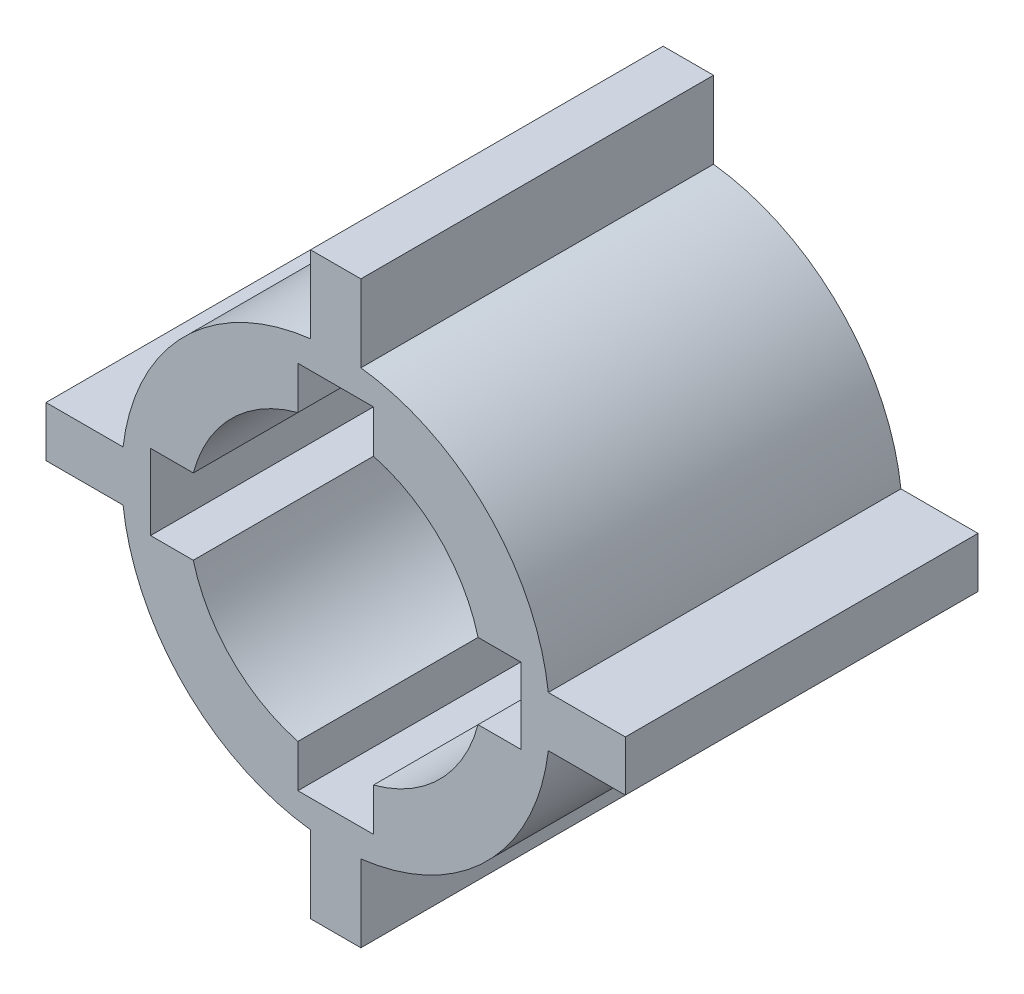
from build123d import *

# Parameters (mm, degrees)
BOSS_EXTRUDE1_DEPTH = 14


with BuildPart() as part:
    # Sketch1 → Boss-Extrude1 (new body)
    with BuildSketch(Plane.XY):
        with BuildLine():
            Line((-1, 8.440971508), (-1, 11.5))
            Line((-1, 11.5), (1, 11.5))
            Line((1, 11.5), (1, 8.440971508))
            ThreePointArc((1, 8.440971508), (6.01040764, 6.01040764), (8.440971508, 1))
            Line((8.440971508, 1), (11.5, 1))
            Line((11.5, 1), (11.5, -1))
            Line((11.5, -1), (8.440971508, -1))
            ThreePointArc((8.440971508, -1), (6.01040764, -6.01040764), (1, -8.440971508))
            Line((1, -8.440971508), (1, -11.5))
            Line((1, -11.5), (-1, -11.5))
            Line((-1, -11.5), (-1, -8.440971508))
            ThreePointArc((-1, -8.440971508), (-6.01040764, -6.01040764), (-8.440971508, -1))
            Line((-8.440971508, -1), (-11.5, -1))
            Line((-11.5, -1), (-11.5, 1))
            Line((-11.5, 1), (-8.440971508, 1))
            ThreePointArc((-8.440971508, 1), (-6.01040764, 6.01040764), (-1, 8.440971508))
        make_face()
        with BuildLine():
            Line((-1.5, 5.652839314), (-1.5, 7.348469228))
            Line((-1.5, 7.348469228), (1.5, 7.348469228))
            Line((1.5, 7.348469228), (1.5, 5.652839314))
            ThreePointArc((1.5, 5.652839314), (4.135492251, 4.135492251), (5.652839314, 1.5))
            Line((5.652839314, 1.5), (7.348469228, 1.5))
            Line((7.348469228, 1.5), (7.348469228, -1.5))
            Line((7.348469228, -1.5), (5.652839314, -1.5))
            ThreePointArc((5.652839314, -1.5), (4.135492251, -4.135492251), (1.5, -5.652839314))
            Line((1.5, -5.652839314), (1.5, -7.348469228))
            Line((1.5, -7.348469228), (-1.5, -7.348469228))
            Line((-1.5, -7.348469228), (-1.5, -5.652839314))
            ThreePointArc((-1.5, -5.652839314), (-4.135492251, -4.135492251), (-5.652839314, -1.5))
            Line((-5.652839314, -1.5), (-7.348469228, -1.5))
            Line((-7.348469228, -1.5), (-7.348469228, 1.5))
            Line((-7.348469228, 1.5), (-5.652839314, 1.5))
            ThreePointArc((-5.652839314, 1.5), (-4.135492251, 4.135492251), (-1.5, 5.652839314))
        make_face(mode=Mode.SUBTRACT)
    extrude(amount=BOSS_EXTRUDE1_DEPTH)


solid = part.part
